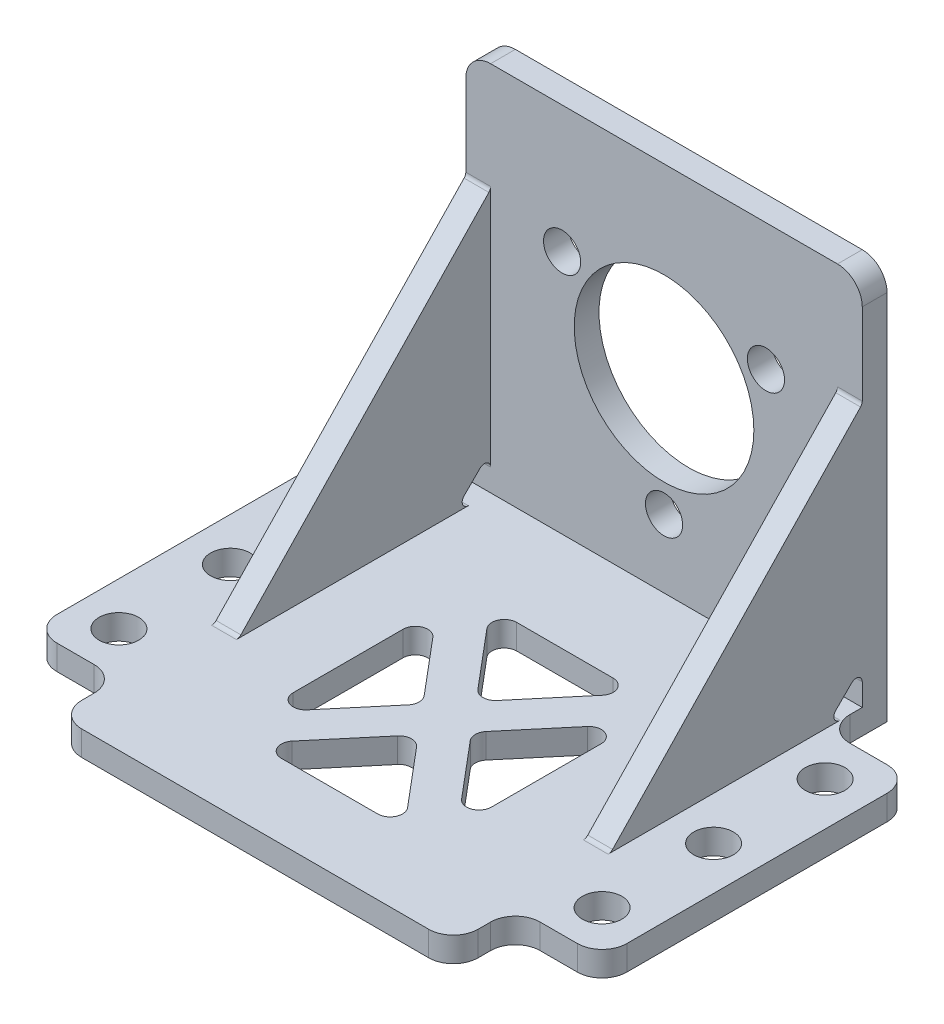
from build123d import *

# Parameters (mm, degrees)
SKETCH2_W           = 32
SKETCH2_H           = 30
SKETCH2_R           = 1.25
SKETCH2_R_2         = 7.25
BOSS_EXTRUDE1_DEPTH = 2
SKETCH2_4_W         = 32
SKETCH2_4_H         = 2
BOSS_EXTRUDE2_DEPTH = 35
BOSS_EXTRUDE3_DEPTH = 2
FILLET1_R           = 2
SKETCH5_W           = 7
SKETCH5_H           = 25
SKETCH5_R           = 1.6
BOSS_EXTRUDE4_DEPTH = 2
FILLET2_R           = 2
SKETCH14_W          = 16
SKETCH14_H          = 19
CUT_EXTRUDE1_DEPTH  = 52.51698749
CUT_EXTRUDE2_DEPTH  = 56.090834083
EXTRUDE_THIN1_DEPTH = 2
FILLET3_R           = 1
FILLET4_R           = 0.5
SKETCH21_R          = 1.5
CUT_EXTRUDE3_DEPTH  = 10


with BuildPart() as part:
    # Sketch2 → Boss-Extrude1 (new body)
    with BuildSketch(Plane.XY):
        Rectangle(SKETCH2_W, SKETCH2_H)
        with Locations((-8.227241336, 4.75)):
            Circle(SKETCH2_R, mode=Mode.SUBTRACT)
        with Locations((8.227241336, 4.75)):
            Circle(SKETCH2_R, mode=Mode.SUBTRACT)
        with Locations((0, -9.5)):
            Circle(SKETCH2_R, mode=Mode.SUBTRACT)
        Circle(SKETCH2_R_2, mode=Mode.SUBTRACT)
    extrude(amount=BOSS_EXTRUDE1_DEPTH)

    # Sketch2<4> → Boss-Extrude2 (add)
    with BuildSketch(Plane.XY):
        with Locations((0, -16)):
            Rectangle(SKETCH2_4_W, SKETCH2_4_H)
    extrude(amount=BOSS_EXTRUDE2_DEPTH)

    # Sketch3 → Boss-Extrude3 (add)
    with BuildSketch(Plane(origin=(16, 0, 0), x_dir=(0, 0, -1), z_dir=(1, 0, 0))):
        Polygon((-2, 6.21520857), (-22.300940927, -15), (-2, -15), align=None)
    boss_extrude3 = extrude(amount=-BOSS_EXTRUDE3_DEPTH)

    # Mirror1: Boss-Extrude3 across plane
    add(boss_extrude3.mirror(Plane.ZY))

    # Fillet1
    fillet1_edges = [part.edges().sort_by_distance(p)[0] for p in [
        (-16, 15, 1),
        (16, 15, 1),
    ]]
    fillet(fillet1_edges, radius=FILLET1_R)

    # Sketch5 → Boss-Extrude4 (add)
    # profile 1 of 2: a face of its own
    with BuildSketch(Plane(origin=(0, -15, 0), x_dir=(1, 0, 0), z_dir=(0, 1, 0))):
        with Locations((19.5, -17.5)):
            Rectangle(SKETCH5_W, SKETCH5_H)
        with Locations(Location((19.5, -26.5, 0), (0, 0, 180))):
            Circle(SKETCH5_R, mode=Mode.SUBTRACT)
        with Locations(Location((19.5, -17.5, 0), (0, 0, 180))):
            Circle(SKETCH5_R, mode=Mode.SUBTRACT)
        with Locations(Location((19.5, -8.5, 0), (0, 0, 180))):
            Circle(SKETCH5_R, mode=Mode.SUBTRACT)
    # profile 2 of 2: a face of its own
    with BuildSketch(Plane(origin=(0, -15, 0), x_dir=(1, 0, 0), z_dir=(0, 1, 0))):
        with Locations((-19.5, -17.5)):
            Rectangle(SKETCH5_W, SKETCH5_H)
        with Locations(Location((-19.5, -26.5, 0), (0, 0, 180))):
            Circle(SKETCH5_R, mode=Mode.SUBTRACT)
        with Locations(Location((-19.5, -17.5, 0), (0, 0, 180))):
            Circle(SKETCH5_R, mode=Mode.SUBTRACT)
        with Locations(Location((-19.5, -8.5, 0), (0, 0, 180))):
            Circle(SKETCH5_R, mode=Mode.SUBTRACT)
    extrude(amount=-BOSS_EXTRUDE4_DEPTH)

    # Fillet2
    fillet2_edges = [part.edges().sort_by_distance(p)[0] for p in [
        (-23, -16, 5),
        (-16, -16, 5),
        (-16, -16, 30),
        (16, -16, 35),
        (-16, -16, 35),
        (23, -16, 30),
        (16, -16, 30),
        (16, -16, 5),
        (23, -16, 5),
        (-23, -16, 30),
    ]]
    fillet(fillet2_edges, radius=FILLET2_R)

    # Sketch14 → Cut-Extrude1 (cut, through all)
    with BuildSketch(Plane(origin=(0, -15, 0), x_dir=(1, 0, 0), z_dir=(0, 1, 0))):
        with Locations((0, -19.5)):
            Rectangle(SKETCH14_W, SKETCH14_H)
    extrude(amount=-CUT_EXTRUDE1_DEPTH, mode=Mode.SUBTRACT)

    # Sketch20 → Cut-Extrude2 (cut, through all)
    with BuildSketch(Plane.ZY.offset(16)):
        Polygon((2, -12), (5, -15), (2, -15), align=None)
    extrude(amount=-CUT_EXTRUDE2_DEPTH, mode=Mode.SUBTRACT)

    # Sketch15 → Extrude-Thin1 (add)
    with BuildSketch(Plane(origin=(0, -15, 0), x_dir=(1, 0, 0), z_dir=(0, 1, 0))):
        Polygon((6.852633203, -9.033796381), (-9.147366797, -28.033796381), (-6.852633203, -29.966203619), (9.147366797, -10.966203619), align=None)
        Polygon((-9.147366797, -10.966203619), (6.852633203, -29.966203619), (9.147366797, -28.033796381), (-6.852633203, -9.033796381), align=None)
    extrude(amount=-EXTRUDE_THIN1_DEPTH)

    # Fillet3
    fillet3_edges = [part.edges().sort_by_distance(p)[0] for p in [
        (-6.03898805, -16, 10),
        (6.03898805, -16, 10),
        (-8, -16, 12.32870169),
        (-8, -16, 26.67129831),
        (6.03898805, -16, 29),
        (-6.03898805, -16, 29),
        (8, -16, 26.67129831),
        (8, -16, 12.32870169),
        (1.96101195, -16, 19.5),
        (0, -16, 21.82870169),
        (-1.96101195, -16, 19.5),
        (0, -16, 17.17129831),
    ]]
    fillet(fillet3_edges, radius=FILLET3_R)

    # Fillet4
    fillet4_edges = [part.edges().sort_by_distance(p)[0] for p in [
        (15, -12, 2),
        (15, -15, 5),
        (-15, -15, 5),
        (-15, -12, 2),
        (15, 6.21520857, 2),
        (15, -15, 22.300940927),
        (-15, 6.21520857, 2),
        (-15, -15, 22.300940927),
    ]]
    fillet(fillet4_edges, radius=FILLET4_R)

    # Sketch21 → Cut-Extrude3 (cut)
    with BuildSketch(Plane(origin=(0, 0, 0), x_dir=(-1, 0, 0), z_dir=(0, 0, -1))):
        with Locations((-8.227241336, 4.75)):
            Circle(SKETCH21_R)
        with Locations((8.227241336, 4.75)):
            Circle(SKETCH21_R)
        with Locations((0, -9.5)):
            Circle(SKETCH21_R)
    extrude(amount=-CUT_EXTRUDE3_DEPTH, mode=Mode.SUBTRACT)


solid = part.part
